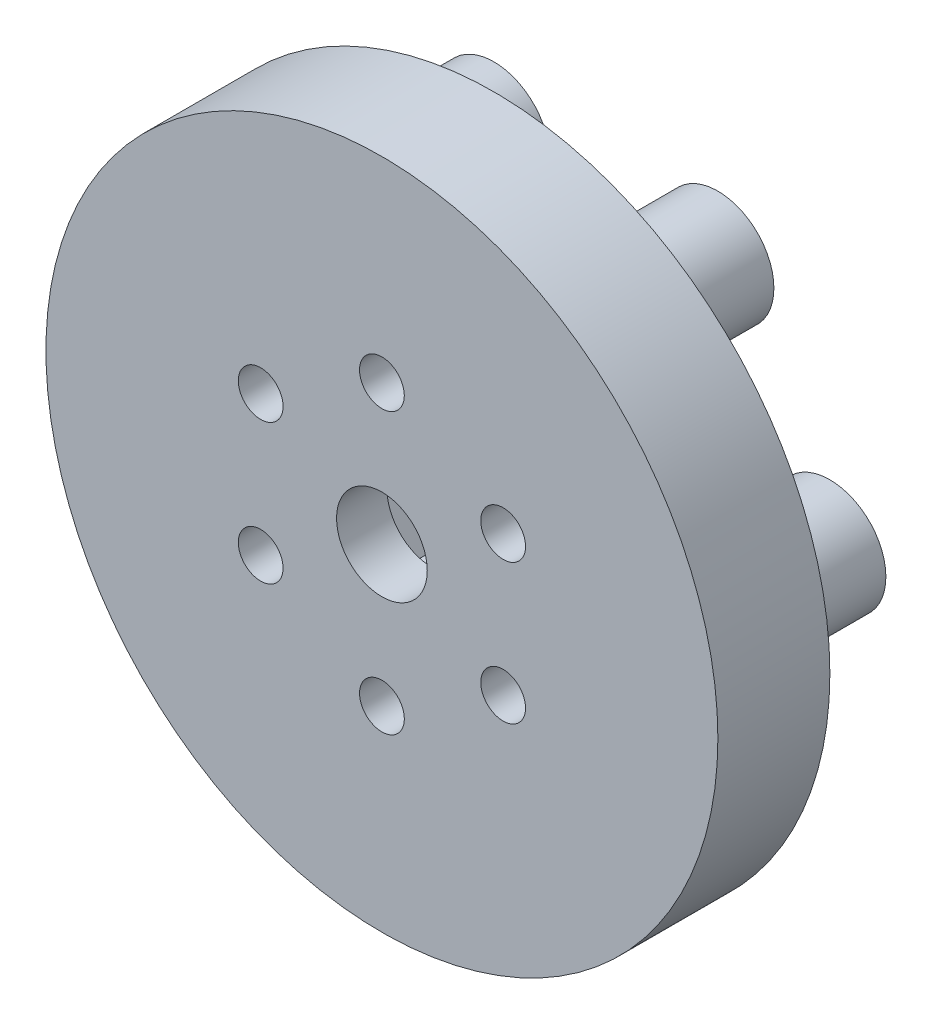
from build123d import *

# Parameters (mm, degrees)
SKETCH1_R             = 5
BOSS_EXTRUDE1_DEPTH   = 10
BOSS_EXTRUDE1_2_DEPTH = 10
BOSS_EXTRUDE1_3_DEPTH = 10
BOSS_EXTRUDE1_4_DEPTH = 10
BOSS_EXTRUDE1_5_DEPTH = 10
BOSS_EXTRUDE1_6_DEPTH = 10
SKETCH2_R             = 30
SKETCH2_R_2           = 4.05
SKETCH2_R_3           = 2
BOSS_EXTRUDE2_DEPTH   = 10
CUT_EXTRUDE1_DEPTH    = 5.5


with BuildPart() as part:
    # Sketch1 → Boss-Extrude1 (new body)
    with BuildSketch(Plane.XY):
        with Locations((20, 0)):
            Circle(SKETCH1_R)
    extrude(amount=BOSS_EXTRUDE1_DEPTH)



with BuildPart() as body_2:
    # Sketch1 → Boss-Extrude1 2 (new body)
    with BuildSketch(Plane.XY):
        with Locations((10, -17.320508076)):
            Circle(SKETCH1_R)
    extrude(amount=BOSS_EXTRUDE1_2_DEPTH)


with BuildPart() as body_3:
    # Sketch1 → Boss-Extrude1 3 (new body)
    with BuildSketch(Plane.XY):
        with Locations((-10, -17.320508076)):
            Circle(SKETCH1_R)
    extrude(amount=BOSS_EXTRUDE1_3_DEPTH)


with BuildPart() as body_4:
    # Sketch1 → Boss-Extrude1 4 (new body)
    with BuildSketch(Plane.XY):
        with Locations((-20, 0)):
            Circle(SKETCH1_R)
    extrude(amount=BOSS_EXTRUDE1_4_DEPTH)


with BuildPart() as body_5:
    # Sketch1 → Boss-Extrude1 5 (new body)
    with BuildSketch(Plane.XY):
        with Locations((-10, 17.320508076)):
            Circle(SKETCH1_R)
    extrude(amount=BOSS_EXTRUDE1_5_DEPTH)


with BuildPart() as body_6:
    # Sketch1 → Boss-Extrude1 6 (new body)
    with BuildSketch(Plane.XY):
        with Locations((10, 17.320508076)):
            Circle(SKETCH1_R)
    extrude(amount=BOSS_EXTRUDE1_6_DEPTH)


with BuildPart() as part_1:
    add(part.part)

    add(body_2.part)  # Boss-Extrude2 merges body 2

    add(body_3.part)  # Boss-Extrude2 merges body 3

    add(body_4.part)  # Boss-Extrude2 merges body 4

    add(body_5.part)  # Boss-Extrude2 merges body 5

    add(body_6.part)  # Boss-Extrude2 merges body 6
    # Sketch2 → Boss-Extrude2 (add)
    with BuildSketch(Plane.XY.offset(10)):
        Circle(SKETCH2_R)
        Circle(SKETCH2_R_2, mode=Mode.SUBTRACT)
        with Locations((-0.00055318, 12.499999988)):
            Circle(SKETCH2_R_3, mode=Mode.SUBTRACT)
        with Locations((10.825540946, 6.251345088)):
            Circle(SKETCH2_R_3, mode=Mode.SUBTRACT)
        with Locations((10.827094127, -6.2486549)):
            Circle(SKETCH2_R_3, mode=Mode.SUBTRACT)
        with Locations((0.00255318, -12.499999988)):
            Circle(SKETCH2_R_3, mode=Mode.SUBTRACT)
        with Locations((-10.823540946, -6.251345088)):
            Circle(SKETCH2_R_3, mode=Mode.SUBTRACT)
        with Locations((-10.825094127, 6.2486549)):
            Circle(SKETCH2_R_3, mode=Mode.SUBTRACT)
    extrude(amount=BOSS_EXTRUDE2_DEPTH)

    # Sketch5 → Cut-Extrude1 (cut)
    with BuildSketch(Plane(origin=(0, 0, 10), x_dir=(-1, 0, 0), z_dir=(0, 0, -1))):
        Polygon((7.621014042, 0.012040338), (3.800079783, 6.606011932), (-3.82093426, 6.593971594), (-7.621014042, -0.012040338), (-3.800079783, -6.606011932), (3.82093426, -6.593971594), align=None)
    extrude(amount=-CUT_EXTRUDE1_DEPTH, mode=Mode.SUBTRACT)


solid = part_1.part
